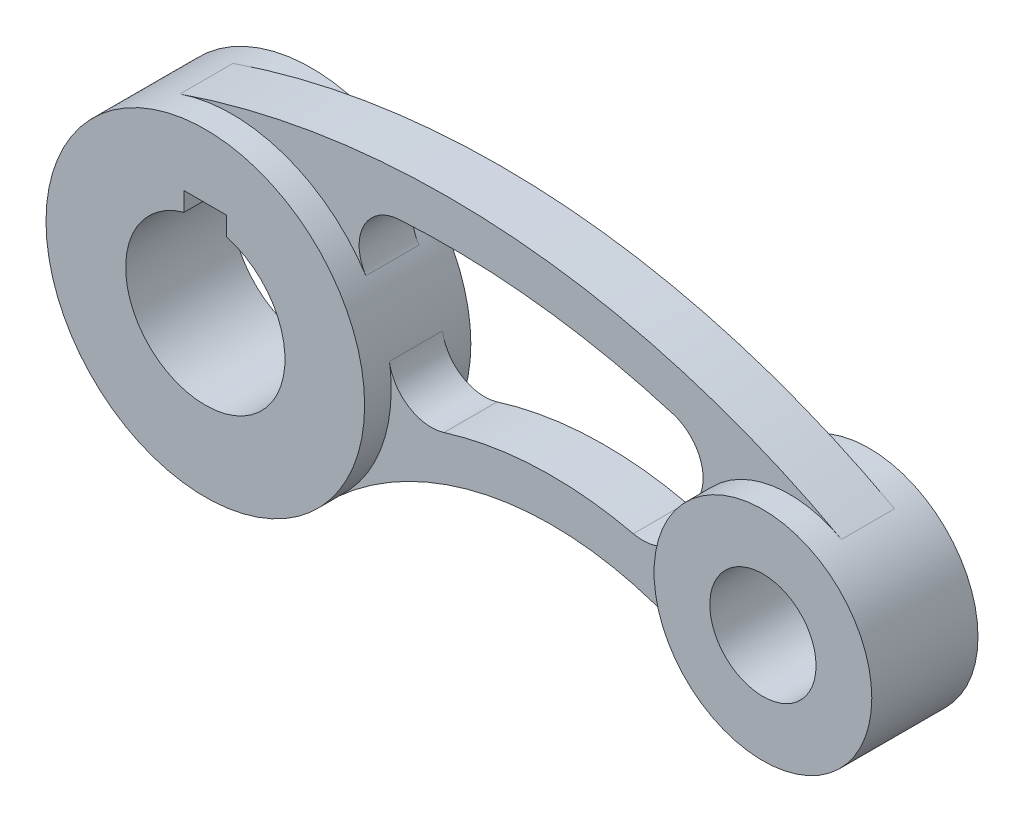
from build123d import *

# Parameters (mm, degrees)
BOSS_EXTRUDE1_DEPTH        = 10
BOSS_EXTRUDE1_DEPTH_BACK   = 10
SKETCH1_R                  = 20.5
SKETCH1_R_2                = 10
BOSS_EXTRUDE1_2_DEPTH      = 10
BOSS_EXTRUDE1_2_DEPTH_BACK = 10
SKETCH1_R_3                = 30
BOSS_EXTRUDE3_DEPTH        = 5
BOSS_EXTRUDE3_DEPTH_BACK   = 5


with BuildPart() as part:
    # Sketch1 → Boss-Extrude1 (new, two sides: drawn at the far end of the back side and taken through both)
    with BuildSketch(Plane.XY.offset(-BOSS_EXTRUDE1_DEPTH_BACK)):
        Circle(SKETCH1_R)
        Circle(SKETCH1_R_2, mode=Mode.SUBTRACT)
    extrude(amount=BOSS_EXTRUDE1_DEPTH + BOSS_EXTRUDE1_DEPTH_BACK)



with BuildPart() as body_2:
    # Sketch1 → Boss-Extrude1 2 (new, two sides: drawn at the far end of the back side and taken through both)
    with BuildSketch(Plane.XY.offset(-BOSS_EXTRUDE1_2_DEPTH_BACK)):
        with Locations((-105, 0)):
            Circle(SKETCH1_R_3)
        with BuildLine():
            Line((-101, 18), (-101, 14.456832295))
            ThreePointArc((-101, 14.456832295), (-105, -15), (-109, 14.456832295))
            Line((-109, 14.456832295), (-109, 18))
            Line((-109, 18), (-101, 18))
        make_face(mode=Mode.SUBTRACT)
    extrude(amount=BOSS_EXTRUDE1_2_DEPTH + BOSS_EXTRUDE1_2_DEPTH_BACK)


with BuildPart() as part_1:
    add(part.part)

    add(body_2.part)  # Boss-Extrude3 merges body 2
    # Sketch1<5> → Boss-Extrude3 (add, two sides: drawn at the far end of the back side and taken through both)
    with BuildSketch(Plane.XY.offset(-BOSS_EXTRUDE3_DEPTH_BACK)):
        with BuildLine():
            ThreePointArc((-84.928968254, -22.296943393), (-49.070592623, -7.043942052), (-11.40536084, -17.034310791))
            ThreePointArc((-11.40536084, -17.034310791), (-19.158178407, -7.294806381), (-19.846557236, 5.134604745))
            ThreePointArc((-19.846557236, 5.134604745), (-23.446258475, 0.296093427), (-29.401591979, -0.654192653))
            ThreePointArc((-29.401591979, -0.654192653), (-47.309577117, 1.062360507), (-65.040995656, -1.977258391))
            ThreePointArc((-65.040995656, -1.977258391), (-71.669449556, -1.120833178), (-75.334602536, 4.468130848))
            ThreePointArc((-75.334602536, 4.468130848), (-76.759596366, -10.123220958), (-84.928968254, -22.296943393))
        make_face()
        with BuildLine():
            ThreePointArc((-17.449330151, 10.759687601), (-5.273160122, 19.810193899), (9.791117897, 18.010663795))
            ThreePointArc((9.791117897, 18.010663795), (-51.406147601, 36.300304325), (-114.782571429, 28.360206209))
            ThreePointArc((-114.782571429, 28.360206209), (-95.177372737, 28.346357679), (-79.767134466, 16.226598441))
            ThreePointArc((-79.767134466, 16.226598441), (-80.178220113, 24.162367707), (-73.54479246, 28.537646307))
            ThreePointArc((-73.54479246, 28.537646307), (-47.487956655, 27.874909654), (-21.957791125, 22.620524811))
            ThreePointArc((-21.957791125, 22.620524811), (-16.78083736, 17.80107195), (-17.449330151, 10.759687601))
        make_face()
    extrude(amount=BOSS_EXTRUDE3_DEPTH + BOSS_EXTRUDE3_DEPTH_BACK)


solid = part_1.part
